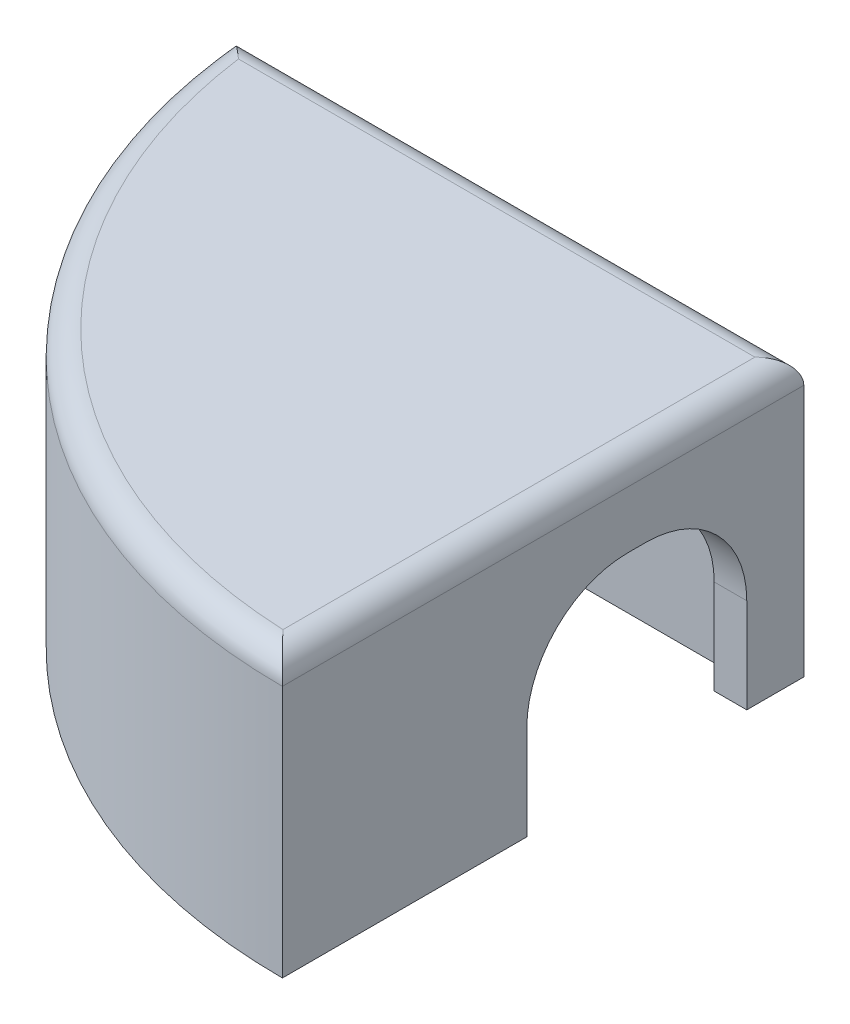
from build123d import *

# Parameters (mm, degrees)
BOSS_EXTRUDE5_DEPTH = 15
BOSS_EXTRUDE6_DEPTH = 2
FILLET2_R           = 1.5
SKETCH7_W           = 13.5
SKETCH7_H           = 12
CUT_EXTRUDE2_DEPTH  = 5
FILLET3_R           = 6.2


with BuildPart() as part:
    # Sketch4 → Boss-Extrude5 (new body)
    with BuildSketch(Plane(origin=(0, 0, 0), x_dir=(1, 0, 0), z_dir=(0, 1, 0))):
        with BuildLine():
            Line((-60, -3), (-94.871191548, -3))
            ThreePointArc((-94.871191548, -3), (-83.664319132, -25.787593916), (-60, -35))
            Line((-60, -35), (-60, -3))
        make_face()
        with BuildLine():
            Line((-62, -5), (-93.12476415, -5))
            ThreePointArc((-93.12476415, -5), (-82.597547458, -24.730565074), (-62, -33.440245214))
            Line((-62, -33.440245214), (-62, -5))
        make_face(mode=Mode.SUBTRACT)
    extrude(amount=BOSS_EXTRUDE5_DEPTH)

    # Sketch5 → Boss-Extrude6 (add)
    with BuildSketch(Plane(origin=(0, 15, 0), x_dir=(1, 0, 0), z_dir=(0, 1, 0))):
        with BuildLine():
            Line((-60, -3), (-94.871191548, -3))
            ThreePointArc((-94.871191548, -3), (-83.664319132, -25.787593916), (-60, -35))
            Line((-60, -35), (-60, -3))
        make_face()
    extrude(amount=BOSS_EXTRUDE6_DEPTH)

    # Fillet2
    fillet2_edges = [part.edges().sort_by_distance(p)[0] for p in [
        (-60, 17, 19),
        (-77.435595774, 17, 3),
        (-83.664319132, 17, 25.787593916),
    ]]
    fillet(fillet2_edges, radius=FILLET2_R)

    # Sketch7 → Cut-Extrude2 (cut)
    with BuildSketch(Plane(origin=(-60, 0, 0), x_dir=(0, 0, -1), z_dir=(1, 0, 0))):
        with Locations((-13.25, 6)):
            Rectangle(SKETCH7_W, SKETCH7_H)
    extrude(amount=-CUT_EXTRUDE2_DEPTH, mode=Mode.SUBTRACT)

    # Fillet3
    fillet3_edges = [part.edges().sort_by_distance(p)[0] for p in [
        (-61, 12, 20),
        (-61, 12, 6.5),
    ]]
    fillet(fillet3_edges, radius=FILLET3_R)


solid = part.part
